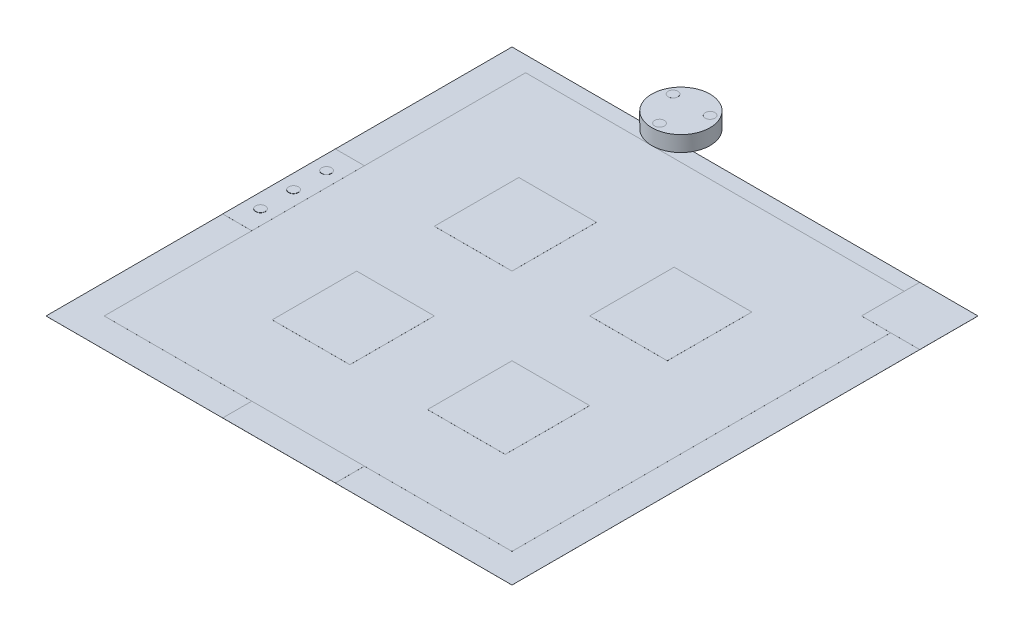
from build123d import *

# Parameters (mm, degrees)
SKETCH_1_W       = 2400
SKETCH_1_H       = 2400
EXTRUDE_1_DEPTH  = 0.1
SKETCH_3_W       = 2100
SKETCH_3_H       = 2170
SKETCH_3_W_2     = 1200
SKETCH_3_H_2     = 1270
SKETCH_3_W_3     = 400
SKETCH_3_H_3     = 435
SKETCH_3_H_4     = 400
EXTRUDE_5_DEPTH  = 0.1
SKETCH_4_W       = 300
SKETCH_4_H       = 300
EXTRUDE_7_DEPTH  = 0.1
SKETCH_5_W       = 580
SKETCH_5_H       = 150
EXTRUDE_9_DEPTH  = 0.2
SKETCH_6_W       = 150
SKETCH_6_H       = 580
EXTRUDE_10_DEPTH = 0.2
SKETCH_7_W       = 400
SKETCH_7_H       = 435
EXTRUDE_11_DEPTH = 0.2
SKETCH_10_R      = 150
EXTRUDE_14_DEPTH = 80
SKETCH_11_R      = 25
EXTRUDE_15_DEPTH = 0.1
SKETCH_12_R      = 25
EXTRUDE_16_DEPTH = 1


with BuildPart() as part:
    # 草图1 → 凸台-拉伸1 (new body)
    with BuildSketch(Plane(origin=(0, 0, 0), x_dir=(1, 0, 0), z_dir=(0, 1, 0))):
        Rectangle(SKETCH_1_W, SKETCH_1_H)
    extrude(amount=EXTRUDE_1_DEPTH)

    # 草图3 → 凸台-拉伸5 (add)
    # profile 1 of 10: a face of its own
    with BuildSketch(Plane(origin=(0, 0.1, 0), x_dir=(1, 0, 0), z_dir=(0, 1, 0))):
        with Locations((0, 35)):
            Rectangle(SKETCH_3_W, SKETCH_3_H)
        Rectangle(SKETCH_3_W_2, SKETCH_3_H_2, mode=Mode.SUBTRACT)
    # profile 2 of 10: a face of its own
    with BuildSketch(Plane(origin=(0, 0.1, 0), x_dir=(1, 0, 0), z_dir=(0, 1, 0))):
        with Locations((0, 417.5)):
            Rectangle(SKETCH_3_W_3, SKETCH_3_H_3)
    # profile 3 of 10: a face of its own
    with BuildSketch(Plane(origin=(0, 0.1, 0), x_dir=(1, 0, 0), z_dir=(0, 1, 0))):
        with Locations((0, -417.5)):
            Rectangle(SKETCH_3_W_3, SKETCH_3_H_3)
    # profile 4 of 10: a face of its own
    with BuildSketch(Plane(origin=(0, 0.1, 0), x_dir=(1, 0, 0), z_dir=(0, 1, 0))):
        with Locations((-400, 0)):
            Rectangle(SKETCH_3_W_3, SKETCH_3_H_4)
    # profile 5 of 10: a face of its own
    with BuildSketch(Plane(origin=(0, 0.1, 0), x_dir=(1, 0, 0), z_dir=(0, 1, 0))):
        with Locations((400, 0)):
            Rectangle(SKETCH_3_W_3, SKETCH_3_H_4)
    # profile 6 of 10: a face of its own
    with BuildSketch(Plane(origin=(0, 0.1, 0), x_dir=(1, 0, 0), z_dir=(0, 1, 0))):
        with Locations((-400, -417.5)):
            Rectangle(SKETCH_3_W_3, SKETCH_3_H_3)
    # profile 7 of 10: a face of its own
    with BuildSketch(Plane(origin=(0, 0.1, 0), x_dir=(1, 0, 0), z_dir=(0, 1, 0))):
        Rectangle(SKETCH_3_W_3, SKETCH_3_H_4)
    # profile 8 of 10: a face of its own
    with BuildSketch(Plane(origin=(0, 0.1, 0), x_dir=(1, 0, 0), z_dir=(0, 1, 0))):
        with Locations((-400, 417.5)):
            Rectangle(SKETCH_3_W_3, SKETCH_3_H_3)
    # profile 9 of 10: a face of its own
    with BuildSketch(Plane(origin=(0, 0.1, 0), x_dir=(1, 0, 0), z_dir=(0, 1, 0))):
        with Locations((400, 417.5)):
            Rectangle(SKETCH_3_W_3, SKETCH_3_H_3)
    # profile 10 of 10: a face of its own
    with BuildSketch(Plane(origin=(0, 0.1, 0), x_dir=(1, 0, 0), z_dir=(0, 1, 0))):
        with Locations((400, -417.5)):
            Rectangle(SKETCH_3_W_3, SKETCH_3_H_3)
    extrude(amount=EXTRUDE_5_DEPTH)

    # 草图4 → 凸台-拉伸7 (add)
    with BuildSketch(Plane(origin=(0, 0.2, 0), x_dir=(1, 0, 0), z_dir=(0, 1, 0))):
        with Locations((1050, 1050)):
            Rectangle(SKETCH_4_W, SKETCH_4_H)
    extrude(amount=EXTRUDE_7_DEPTH)

    # 草图5 → 凸台-拉伸9 (add)
    with BuildSketch(Plane(origin=(0, 0.1, 0), x_dir=(1, 0, 0), z_dir=(0, 1, 0))):
        with Locations((0, -1125)):
            Rectangle(SKETCH_5_W, SKETCH_5_H)
    extrude(amount=EXTRUDE_9_DEPTH)

    # 草图6 → 凸台-拉伸10 (add)
    with BuildSketch(Plane(origin=(0, 0.1, 0), x_dir=(1, 0, 0), z_dir=(0, 1, 0))):
        with Locations((-1125, 0)):
            Rectangle(SKETCH_6_W, SKETCH_6_H)
    extrude(amount=EXTRUDE_10_DEPTH)

    # 草图7 → 凸台-拉伸11 (add)
    with BuildSketch(Plane(origin=(0, 0.2, 0), x_dir=(1, 0, 0), z_dir=(0, 1, 0))):
        with Locations((400, 417.5)):
            Rectangle(SKETCH_7_W, SKETCH_7_H)
        with Locations((400, -417.5)):
            Rectangle(SKETCH_7_W, SKETCH_7_H)
        with Locations((-400, -417.5)):
            Rectangle(SKETCH_7_W, SKETCH_7_H)
        with Locations((-400, 417.5)):
            Rectangle(SKETCH_7_W, SKETCH_7_H)
    extrude(amount=EXTRUDE_11_DEPTH)

    # 草图10 → 凸台-拉伸14 (add)
    with BuildSketch(Plane.XZ):
        with Locations(Location((-400, -1269.9, 0), (0, 0, 270))):
            Circle(SKETCH_10_R)
    extrude(amount=-EXTRUDE_14_DEPTH)

    # 草图11 → 凸台-拉伸15 (add)
    with BuildSketch(Plane(origin=(0, 80, 0), x_dir=(1, 0, 0), z_dir=(0, 1, 0))):
        with Locations(Location((-495.262794416, 1324.9, 0), (0, 0, 90))):
            Circle(SKETCH_11_R)
        with Locations(Location((-400, 1159.9, 0), (0, 0, 90))):
            Circle(SKETCH_11_R)
        with Locations(Location((-304.737205584, 1324.9, 0), (0, 0, 90))):
            Circle(SKETCH_11_R)
    extrude(amount=EXTRUDE_15_DEPTH)

    # 草图12 → 凸台-拉伸16 (add)
    with BuildSketch(Plane(origin=(0, 0.3, 0), x_dir=(1, 0, 0), z_dir=(0, 1, 0))):
        with Locations(Location((-1125, 0, 0), (0, 0, 90))):
            Circle(SKETCH_12_R)
        with Locations(Location((-1125, 170, 0), (0, 0, 90))):
            Circle(SKETCH_12_R)
        with Locations(Location((-1125, -170, 0), (0, 0, 90))):
            Circle(SKETCH_12_R)
    extrude(amount=EXTRUDE_16_DEPTH)


solid = part.part
